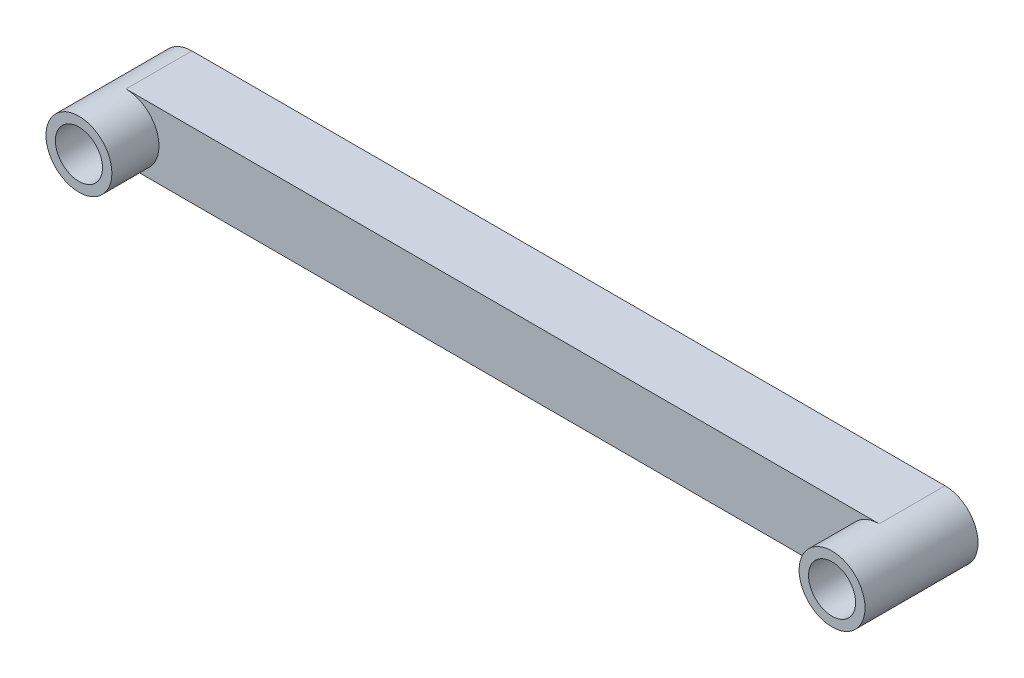
from build123d import *

# Parameters (mm, degrees)
EXTRUDE_2_DEPTH   = 4
SKETCH_1_R        = 5
EXTRUDE_2_2_DEPTH = 4
EXTRUDE_2_3_DEPTH = 4
SKETCH_1_4_R      = 7
SKETCH_1_4_R_2    = 5
EXTRUDE_3_DEPTH   = 14
EXTRUDE_START     = 10
EXTRUDE_4_DEPTH   = 10


with BuildPart() as part:
    # 草图1 → 凸台-拉伸2 (new body)
    with BuildSketch(Plane.XY):
        with BuildLine():
            ThreePointArc((-46.592863908, 7), (-39.592863908, 0), (-46.592863908, -7))
            Line((-46.592863908, -7), (113.407136092, -7))
            ThreePointArc((113.407136092, -7), (106.407136092, 0), (113.407136092, 7))
            Line((113.407136092, 7), (-46.592863908, 7))
        make_face()
    extrude(amount=EXTRUDE_2_DEPTH)



with BuildPart() as body_2:
    # 草图1 → Extrude 2 2 (new body)
    with BuildSketch(Plane.XY):
        with Locations((-46.592863908, 0)):
            Circle(SKETCH_1_R)
    extrude(amount=EXTRUDE_2_2_DEPTH)


with BuildPart() as body_3:
    # 草图1 → Extrude 2 3 (new body)
    with BuildSketch(Plane.XY):
        with Locations((113.407136092, 0)):
            Circle(SKETCH_1_R)
    extrude(amount=EXTRUDE_2_3_DEPTH)


with BuildPart() as part_1:
    add(part.part)

    add(body_2.part)  # 凸台-拉伸3 merges body 2

    add(body_3.part)  # 凸台-拉伸3 merges body 3
    # 草图1<4> → 凸台-拉伸3 (add)
    # profile 1 of 2: a face of its own
    with BuildSketch(Plane.XY):
        with Locations((-46.592863908, 0)):
            Circle(SKETCH_1_4_R)
        with Locations((-46.592863908, 0)):
            Circle(SKETCH_1_4_R_2, mode=Mode.SUBTRACT)
    # profile 2 of 2: a face of its own
    with BuildSketch(Plane.XY):
        with Locations((113.407136092, 0)):
            Circle(SKETCH_1_4_R)
        with Locations((113.407136092, 0)):
            Circle(SKETCH_1_4_R_2, mode=Mode.SUBTRACT)
    extrude(amount=EXTRUDE_3_DEPTH)

    # 草图2 → 凸台-拉伸4 (add)
    with BuildSketch(Plane(origin=(0, 0, 0), x_dir=(-1, 0, 0), z_dir=(0, 0, -1)).offset(EXTRUDE_START)):
        with BuildLine():
            Line((46.592863908, 7), (-113.407136092, 7))
            ThreePointArc((-113.407136092, 7), (-120.407136092, 0), (-113.407136092, -7))
            Line((-113.407136092, -7), (46.592863908, -7))
            ThreePointArc((46.592863908, -7), (53.592863908, 0), (46.592863908, 7))
        make_face()
    extrude(amount=-EXTRUDE_4_DEPTH)


solid = part_1.part
